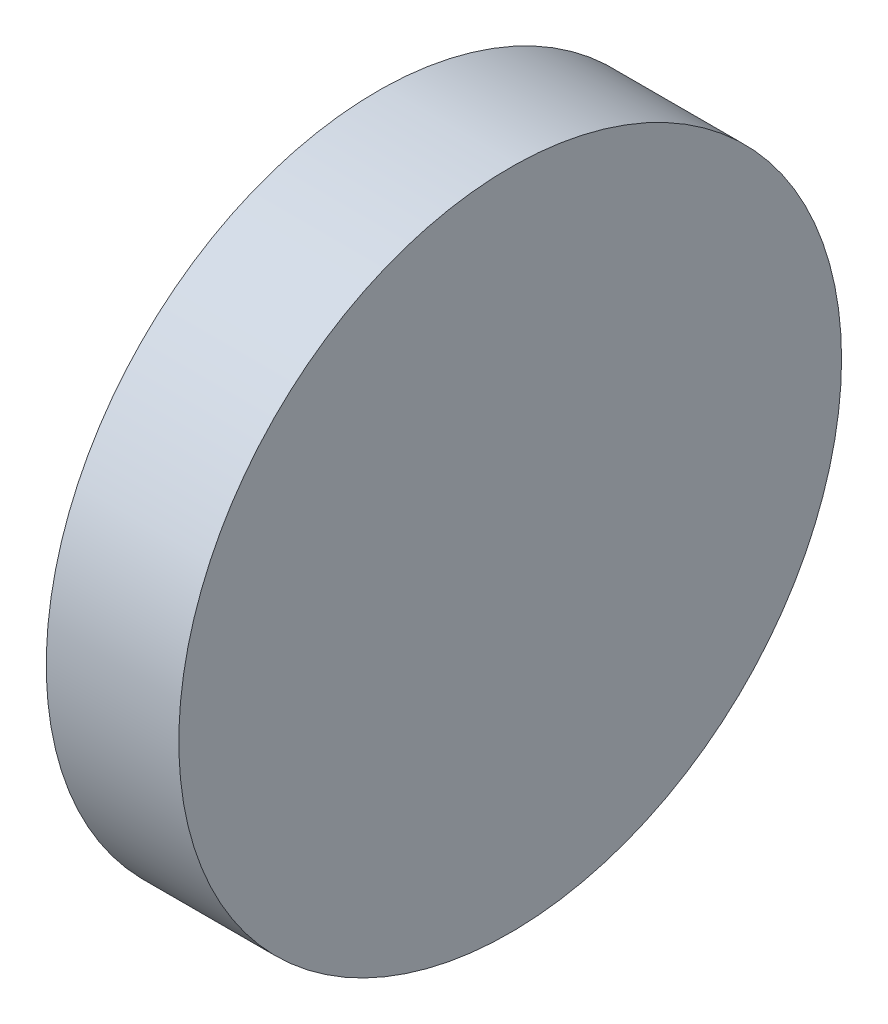
from build123d import *

# Parameters (mm, degrees)
SKETCH_1_R          = 5
EXTRUDE_310_DEPTH   = 2
SKETCH_9_R          = 4.442422665
CUT_EXTRUDE_1_DEPTH = 0.2
SKETCH_10_R         = 3.682968426
EXTRUDE_1_DEPTH     = 0.2
SKETCH_11_R         = 2.01865338
CUT_EXTRUDE_2_DEPTH = 0.2
SKETCH_12_R         = 0.285545309
CUT_EXTRUDE_3_DEPTH = 0.4


with BuildPart() as part:
    # 草图1 → Extrude 310 (new body)
    with BuildSketch(Plane(origin=(0, 0, 0), x_dir=(0, 0, -1), z_dir=(1, 0, 0))):
        Circle(SKETCH_1_R)
    extrude(amount=EXTRUDE_310_DEPTH)

    # 草图9 → 切除-拉伸1 (cut)
    with BuildSketch(Plane.ZY):
        Circle(SKETCH_9_R)
    extrude(amount=-CUT_EXTRUDE_1_DEPTH, mode=Mode.SUBTRACT)

    # 草图10 → 凸台-拉伸1 (add)
    with BuildSketch(Plane.ZY.offset(-0.2)):
        Circle(SKETCH_10_R)
    extrude(amount=EXTRUDE_1_DEPTH)

    # 草图11 → 切除-拉伸2 (cut)
    with BuildSketch(Plane.ZY):
        Circle(SKETCH_11_R)
    extrude(amount=-CUT_EXTRUDE_2_DEPTH, mode=Mode.SUBTRACT)

    # 草图12 → 切除-拉伸3 (cut)
    with BuildSketch(Plane.ZY.offset(-0.2)):
        Circle(SKETCH_12_R)
    extrude(amount=-CUT_EXTRUDE_3_DEPTH, mode=Mode.SUBTRACT)


solid = part.part
